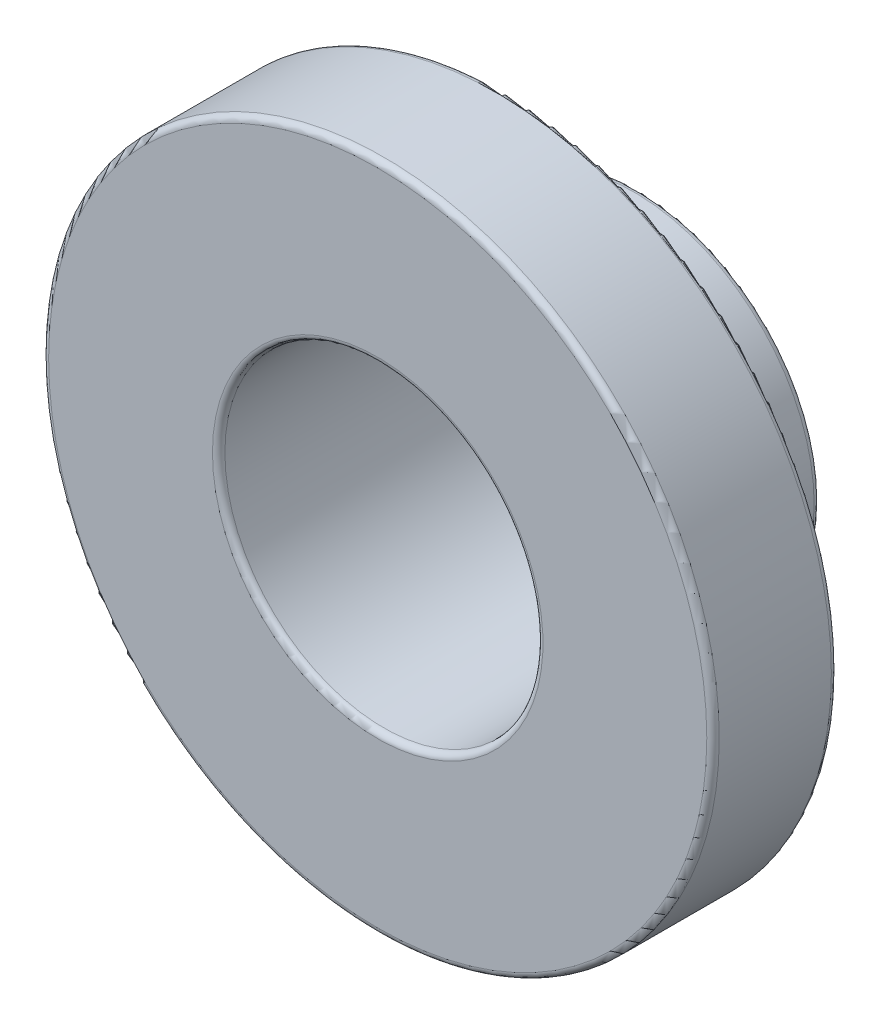
from build123d import *

# Parameters (mm, degrees)
FILLET1_R = 0.05969


with BuildPart() as part:
    # Sketch2 → Revolve1 (revolve)
    with BuildSketch(Plane(origin=(0, 0, 0), x_dir=(0, 0, -1), z_dir=(1, 0, 0)), mode=Mode.PRIVATE) as revolve1_sk:
        Polygon((-1.2573, 1.524), (1.2573, 1.524), (1.2573, 1.7272), (-0.0635, 1.7272), (-0.0635, 3.2131), (-1.2573, 3.2131), align=None)
    revolve(revolve1_sk.sketch.rotate(Axis((0, 0, 1.2573), (0, 0, -1)), 90), axis=Axis((0, 0, 1.2573), (0, 0, -1)))

    # Fillet1
    fillet1_edges = [part.edges().sort_by_distance(p)[0] for p in [
        (-3.2131, 0, 1.2573),
        (-3.2131, 0, 0.0635),
        (-1.7272, 0, 0.0635),
        (-1.7272, 0, -1.2573),
        (-1.524, 0, -1.2573),
        (-1.524, 0, 1.2573),
    ]]
    fillet(fillet1_edges, radius=FILLET1_R)


solid = part.part
